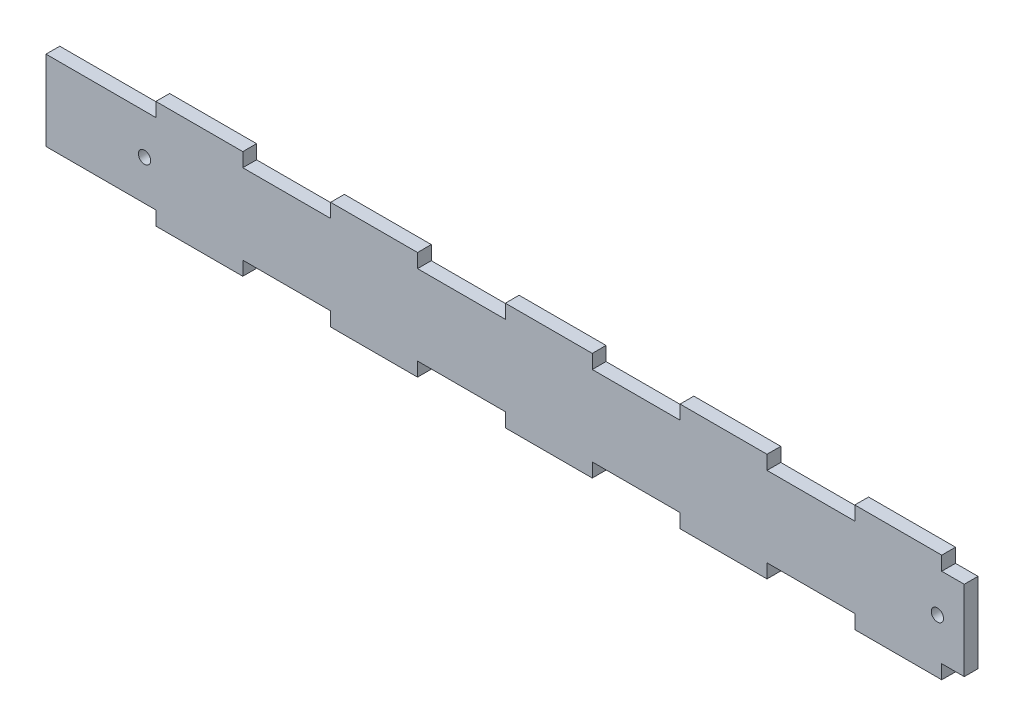
from build123d import *

# Parameters (mm, degrees)
SKETCH1_R           = 1.4
BOSS_EXTRUDE1_DEPTH = 3.15
SKETCH2_R           = 1.4
CUT_EXTRUDE1_DEPTH  = 10


with BuildPart() as part:
    # Sketch1 → Boss-Extrude1 (new body)
    with BuildSketch(Plane.XY):
        Polygon((-60.67170061, 10.980201327), (-60.67170061, -7.339798673), (-35.52170061, -7.339798673), (-35.52170061, -7.389798673), (-35.52170061, -10.539798673), (-15.62170061, -10.539798673), (-15.62170061, -7.339798673), (4.47829939, -7.339798673), (4.47829939, -10.539798673), (24.37829939, -10.539798673), (24.37829939, -7.339798673), (44.47829939, -7.339798673), (44.47829939, -10.539798673), (64.37829939, -10.539798673), (64.37829939, -7.339798673), (84.47829939, -7.339798673), (84.47829939, -10.539798673), (104.37829939, -10.539798673), (104.37829939, -7.339798673), (124.47829939, -7.339798673), (124.47829939, -10.539798673), (144.37829939, -10.539798673), (144.37829939, -7.389798673), (144.37829939, -7.339798673), (144.462459505, -7.339798673), (149.52829939, -7.339798673), (149.52829939, 10.980201327), (144.462459505, 10.980201327), (144.37829939, 10.980201327), (144.37829939, 11.030201327), (144.37829939, 14.180201327), (124.47829939, 14.180201327), (124.47829939, 10.980201327), (104.37829939, 10.980201327), (104.37829939, 14.180201327), (84.47829939, 14.180201327), (84.47829939, 10.980201327), (64.37829939, 10.980201327), (64.37829939, 14.180201327), (44.47829939, 14.180201327), (44.47829939, 10.980201327), (24.37829939, 10.980201327), (24.37829939, 14.180201327), (4.47829939, 14.180201327), (4.47829939, 10.980201327), (-15.62170061, 10.980201327), (-15.62170061, 14.180201327), (-35.52170061, 14.180201327), (-35.52170061, 10.980201327), (-35.57170061, 10.980201327), align=None)
        with Locations((-38.12170061, 1.820201327)):
            Circle(SKETCH1_R, mode=Mode.SUBTRACT)
    extrude(amount=BOSS_EXTRUDE1_DEPTH)

    # Sketch2 → Cut-Extrude1 (cut)
    with BuildSketch(Plane.XY.offset(3.15)):
        with Locations((143.385201149, 1.820201327)):
            Circle(SKETCH2_R)
    extrude(amount=-CUT_EXTRUDE1_DEPTH, mode=Mode.SUBTRACT)


solid = part.part
